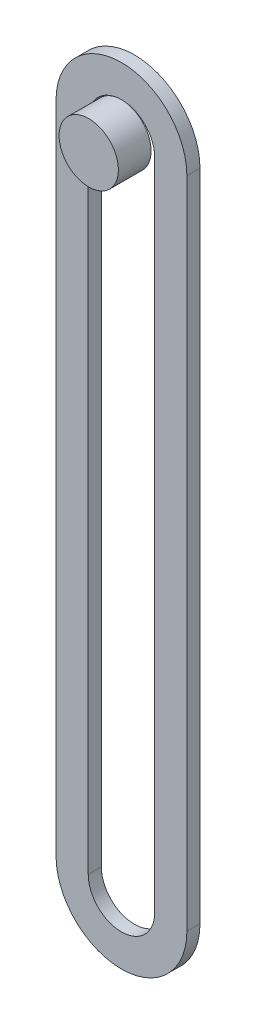
from build123d import *

# Parameters (mm, degrees)
BOSS_EXTRUDE1_DEPTH = 2
SKETCH2_R           = 4.531979256
BOSS_EXTRUDE2_DEPTH = 5


with BuildPart() as part:
    # Sketch1 → Boss-Extrude1 (new body)
    with BuildSketch(Plane.XY):
        with BuildLine():
            Line((-10, -56.052631579), (-10, 43.947368421))
            ThreePointArc((-10, 43.947368421), (0, 53.947368421), (10, 43.947368421))
            Line((10, 43.947368421), (10, -56.052631579))
            ThreePointArc((10, -56.052631579), (0, -66.052631579), (-10, -56.052631579))
        make_face()
        with BuildLine():
            Line((-5.077438158, -56.052631579), (-5.077438158, 43.947368421))
            ThreePointArc((-5.077438158, 43.947368421), (0, 49.024806579), (5.077438158, 43.947368421))
            Line((5.077438158, 43.947368421), (5.077438158, -56.052631579))
            ThreePointArc((5.077438158, -56.052631579), (0, -61.130069737), (-5.077438158, -56.052631579))
        make_face(mode=Mode.SUBTRACT)
    extrude(amount=BOSS_EXTRUDE1_DEPTH)


with BuildPart() as body_2:
    # Sketch2 → Boss-Extrude2 (new body)
    with BuildSketch(Plane.XY.offset(2)):
        with Locations(Location((0, 44.492827323, 0), (0, 0, 180))):
            Circle(SKETCH2_R)
    extrude(amount=BOSS_EXTRUDE2_DEPTH)


solid = Compound([part.part, body_2.part])
